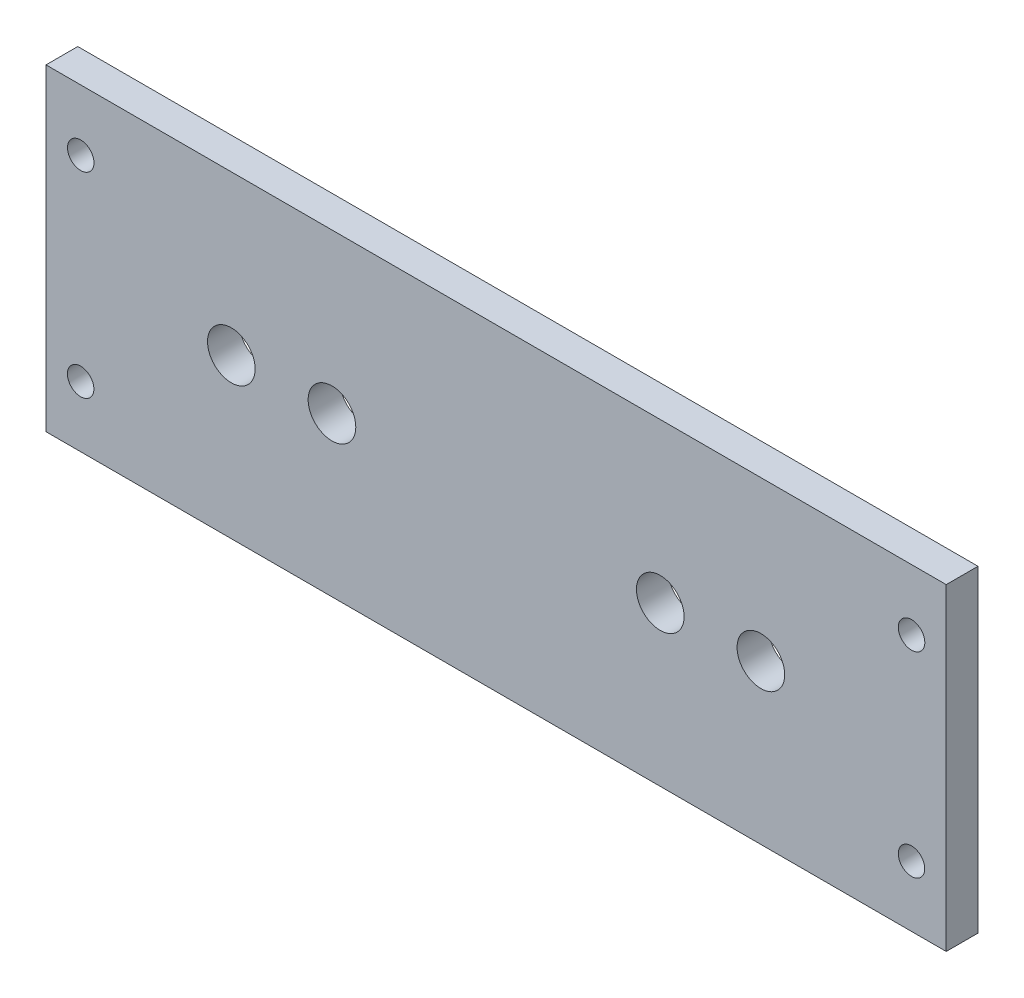
from build123d import *

# Parameters (mm, degrees)
SKETCH1_W           = 170
SKETCH1_H           = 60
SKETCH1_R           = 4.5
SKETCH1_R_2         = 2.5
BOSS_EXTRUDE1_DEPTH = 6


with BuildPart() as part:
    # Sketch1 → Boss-Extrude1 (new body)
    with BuildSketch(Plane(origin=(0, 0, 0), x_dir=(-1, 0, 0), z_dir=(0, 0, -1))):
        with Locations((1, 5)):
            Rectangle(SKETCH1_W, SKETCH1_H)
        with Locations(Location((-30, 5, 0), (0, 0, 180))):
            Circle(SKETCH1_R, mode=Mode.SUBTRACT)
        with Locations(Location((-49, 5, 0), (0, 0, 180))):
            Circle(SKETCH1_R, mode=Mode.SUBTRACT)
        with Locations(Location((32, 5, 0), (0, 0, 180))):
            Circle(SKETCH1_R, mode=Mode.SUBTRACT)
        with Locations(Location((51, 5, 0), (0, 0, 180))):
            Circle(SKETCH1_R, mode=Mode.SUBTRACT)
        with Locations((79.445, 23.5)):
            Circle(SKETCH1_R_2, mode=Mode.SUBTRACT)
        with Locations((79.455, -13.5)):
            Circle(SKETCH1_R_2, mode=Mode.SUBTRACT)
        with Locations((-77.445, -13.5)):
            Circle(SKETCH1_R_2, mode=Mode.SUBTRACT)
        with Locations((-77.455, 23.5)):
            Circle(SKETCH1_R_2, mode=Mode.SUBTRACT)
    extrude(amount=-BOSS_EXTRUDE1_DEPTH)


solid = part.part
